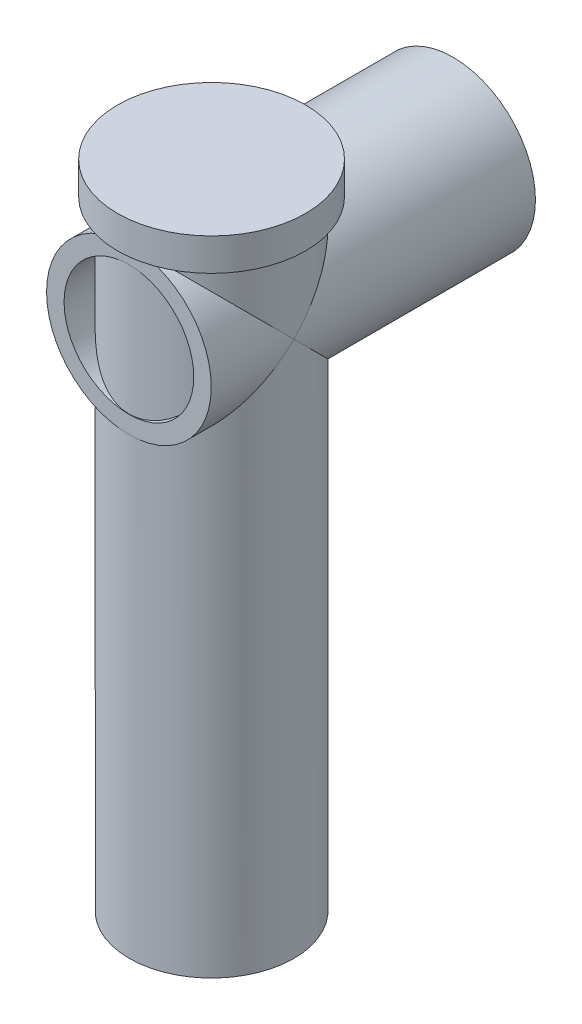
from build123d import *

# Parameters (mm, degrees)
CROQUIS1_R                   = 12.7
CROQUIS1_R_2                 = 10
SALIENTE_EXTRUIR1_DEPTH      = 50
SALIENTE_EXTRUIR2_DEPTH      = 25.4
SALIENTE_EXTRUIR2_DEPTH_BACK = 70
CROQUIS2_R                   = 12.7
CORTAR_EXTRUIR1_DEPTH        = 87.955678423
CORTAR_EXTRUIR1_DEPTH_BACK   = 87.955678423
CROQUIS3_R                   = 10
CROQUIS4_R                   = 10
CORTAR_EXTRUIR2_DEPTH        = 42
CROQUIS5_R                   = 14.5
SALIENTE_EXTRUIR4_DEPTH      = 5


with BuildPart() as part:
    # Croquis1 → Saliente-Extruir1 (new body)
    with BuildSketch(Plane.XY):
        Circle(CROQUIS1_R)
        Circle(CROQUIS1_R_2, mode=Mode.SUBTRACT)
    extrude(amount=SALIENTE_EXTRUIR1_DEPTH)

    # Croquis2 → Saliente-Extruir2 (add, two sides: drawn at the far end of the back side and taken through both)
    with BuildSketch(Plane(origin=(0, -12.7, 0), x_dir=(1, 0, 0), z_dir=(0, 1, 0)).offset(-SALIENTE_EXTRUIR2_DEPTH_BACK)):
        with Locations((0, -37.25)):
            Circle(CROQUIS2_R)
    extrude(amount=SALIENTE_EXTRUIR2_DEPTH + SALIENTE_EXTRUIR2_DEPTH_BACK)

    # Croquis3 → Cortar-Extruir1 (cut, two sides: drawn at the far end of the back side and taken through both)
    with BuildSketch(Plane(origin=(0, -12.7, 0), x_dir=(1, 0, 0), z_dir=(0, 1, 0)).offset(-CORTAR_EXTRUIR1_DEPTH_BACK)):
        with Locations(Location((0, -37.25, 0), (0, 0, 270))):
            Circle(CROQUIS3_R)
    extrude(amount=CORTAR_EXTRUIR1_DEPTH + CORTAR_EXTRUIR1_DEPTH_BACK, mode=Mode.SUBTRACT)

    # Croquis4 → Cortar-Extruir2 (cut)
    with BuildSketch(Plane.XY):
        with Locations(Location((0, 0, 0), (0, 0, 180))):
            Circle(CROQUIS4_R)
    extrude(amount=CORTAR_EXTRUIR2_DEPTH, mode=Mode.SUBTRACT)


with BuildPart() as body_2:
    # Croquis5 → Saliente-Extruir4 (new body)
    with BuildSketch(Plane(origin=(0, 12.7, 0), x_dir=(1, 0, 0), z_dir=(0, 1, 0))):
        with Locations(Location((0, -37.25, 0), (0, 0, 270))):
            Circle(CROQUIS5_R)
    extrude(amount=SALIENTE_EXTRUIR4_DEPTH)


solid = Compound([part.part, body_2.part])
